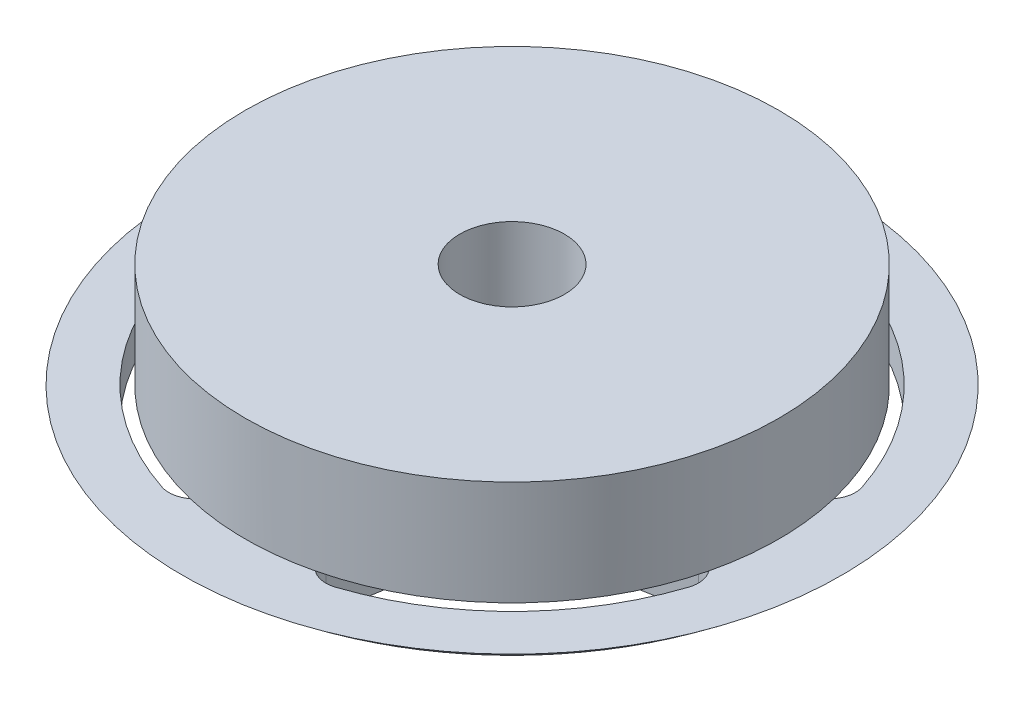
from build123d import *

# Parameters (mm, degrees)
M3X0_5_TAPPED_HOLE1_D     = 2.5
M3X0_5_TAPPED_HOLE1_DEPTH = 7.5
M3X0_5_TAPPED_HOLE1_TIP   = 0.751075774
CUT_EXTRUDE1_DEPTH        = 6
CIRPATTERN1_COUNT         = 4


with BuildPart() as part:
    # Sketch1 → Revolve1 (revolve)
    with BuildSketch(Plane.XY, mode=Mode.PRIVATE) as revolve1_sk:
        with BuildLine():
            Line((-2.5, 2), (-2.5, 0))
            Line((-2.5, 0), (-15, 0))
            ThreePointArc((-15, 0), (-23.778524933, 1.546556434), (-31.5, 6))
            Line((-31.5, 6), (-25.5, 6))
            Line((-25.5, 6), (-25.5, 16))
            Line((-25.5, 16), (-5, 16))
            Line((-5, 16), (-5, 4.5))
            Line((-5, 4.5), (-2.5, 2))
        make_face()
    revolve(revolve1_sk.sketch.rotate(Axis((0, 0, 0), (0, 1, 0)), 270), axis=Axis((0, 0, 0), (0, 1, 0)))

    # M3x0.5 Tapped Hole1
    with Locations(Plane(origin=(0, 0, 0), x_dir=(-1, 0, 0), z_dir=(0, -1, 0))):
        with Locations((12.5, 0), (-12.5, 0), (0, 12.5), (0, -12.5)):
            Hole(M3X0_5_TAPPED_HOLE1_D / 2, depth=M3X0_5_TAPPED_HOLE1_DEPTH)
            with Locations((0, 0, -(M3X0_5_TAPPED_HOLE1_DEPTH + M3X0_5_TAPPED_HOLE1_TIP / 2))):  # 118° drill point
                Cone(0, M3X0_5_TAPPED_HOLE1_D / 2, M3X0_5_TAPPED_HOLE1_TIP, mode=Mode.SUBTRACT)

    # Sketch4 → Cut-Extrude1 (cut)
    with BuildSketch(Plane.XZ):
        with BuildLine():
            Line((-5, -15.811388301), (-5, -22.79802623))
            ThreePointArc((-5, -22.79802623), (-6.034245075, -24.823257699), (-8.28125, -25.172820629))
            ThreePointArc((-8.28125, -25.172820629), (-18.738329701, -18.738329701), (-25.172820629, -8.28125))
            ThreePointArc((-25.172820629, -8.28125), (-24.823257699, -6.034245075), (-22.79802623, -5))
            Line((-22.79802623, -5), (-15.811388301, -5))
            ThreePointArc((-15.811388301, -5), (-14.475082091, -5.387114363), (-13.552618544, -6.428571429))
            ThreePointArc((-13.552618544, -6.428571429), (-10.606601718, -10.606601718), (-6.428571429, -13.552618544))
            ThreePointArc((-6.428571429, -13.552618544), (-5.387114363, -14.475082091), (-5, -15.811388301))
        make_face()
    cut_extrude1 = extrude(amount=-CUT_EXTRUDE1_DEPTH, mode=Mode.SUBTRACT)

    # CirPattern1: Cut-Extrude1 ×4 about axis
    cirpattern1_axis = Axis((0, 0, 0), (0, 1, 0))
    for i in range(1, CIRPATTERN1_COUNT):
        add(cut_extrude1.rotate(cirpattern1_axis, i * 360 / CIRPATTERN1_COUNT), mode=Mode.SUBTRACT)


solid = part.part
